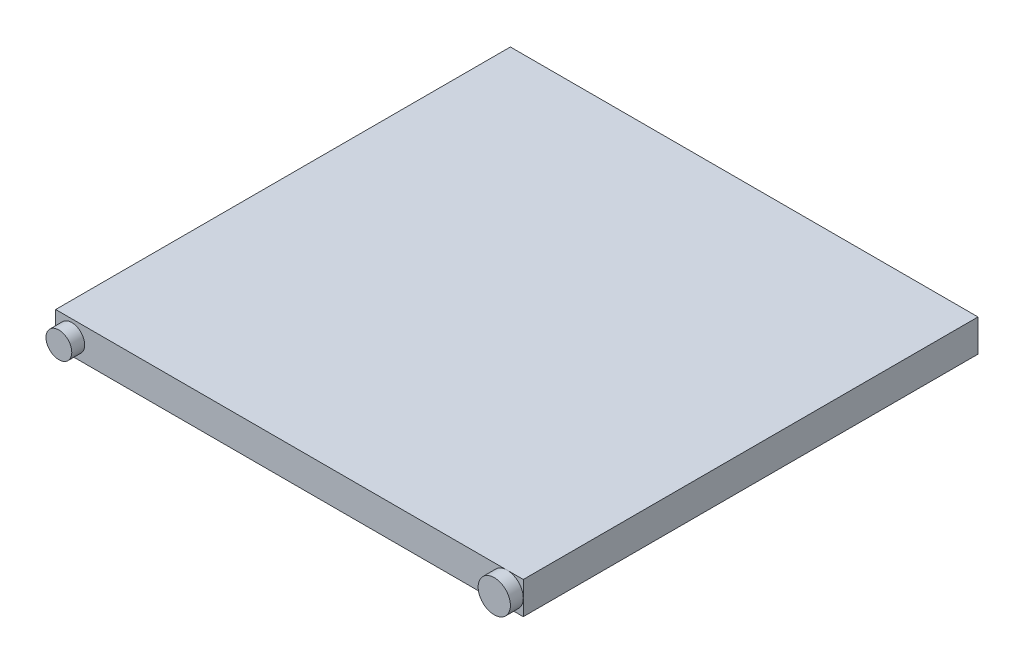
from build123d import *

# Parameters (mm, degrees)
SKETCH1_W                                    = 145
SKETCH1_H                                    = 145
BOSS_EXTRUDE1_PLATE_145X145X10_DEPTH         = 10
SKETCH2_R                                    = 5.5
CUT_EXTRUDE2_DEPTH                           = 3
SKETCH4_OUTSIDE_W                            = 188.06
SKETCH4_OUTSIDE_H                            = 53.06
SKETCH4_OUTSIDE_R                            = 4
SKETCH4_OUTSIDE_R_2                          = 5
CUT_EXTRUDE3_4_COUNTERBORES_8_DEPTH_4M_DEPTH = 4


with BuildPart() as part:
    # Sketch1 → Boss-Extrude1 (Plate 145x145x10) (new body)
    with BuildSketch(Plane(origin=(0, 0, 0), x_dir=(1, 0, 0), z_dir=(0, 1, 0))):
        with Locations((72.5, 72.5)):
            Rectangle(SKETCH1_W, SKETCH1_H)
    extrude(amount=BOSS_EXTRUDE1_PLATE_145X145X10_DEPTH)

    # Sketch2 → Cut-Extrude2 (cut)
    with BuildSketch(Plane(origin=(0, 0, 0), x_dir=(1, 0, 0), z_dir=(0, 1, 0))):
        with Locations(Location((15, 15, 0), (0, 0, 270))):
            Circle(SKETCH2_R)
        with Locations(Location((27.778, 15, 0), (0, 0, 270))):
            Circle(SKETCH2_R)
        with Locations(Location((40.556, 15, 0), (0, 0, 270))):
            Circle(SKETCH2_R)
        with Locations(Location((53.334, 15, 0), (0, 0, 270))):
            Circle(SKETCH2_R)
        with Locations(Location((66.112, 15, 0), (0, 0, 270))):
            Circle(SKETCH2_R)
        with Locations(Location((78.89, 15, 0), (0, 0, 270))):
            Circle(SKETCH2_R)
        with Locations(Location((91.668, 15, 0), (0, 0, 270))):
            Circle(SKETCH2_R)
        with Locations(Location((104.446, 15, 0), (0, 0, 270))):
            Circle(SKETCH2_R)
        with Locations(Location((117.224, 15, 0), (0, 0, 270))):
            Circle(SKETCH2_R)
        with Locations(Location((130.002, 15, 0), (0, 0, 270))):
            Circle(SKETCH2_R)
        with Locations(Location((15, 27.778, 0), (0, 0, 270))):
            Circle(SKETCH2_R)
        with Locations(Location((27.778, 27.778, 0), (0, 0, 270))):
            Circle(SKETCH2_R)
        with Locations(Location((40.556, 27.778, 0), (0, 0, 270))):
            Circle(SKETCH2_R)
        with Locations(Location((53.334, 27.778, 0), (0, 0, 270))):
            Circle(SKETCH2_R)
        with Locations(Location((66.112, 27.778, 0), (0, 0, 270))):
            Circle(SKETCH2_R)
        with Locations(Location((78.89, 27.778, 0), (0, 0, 270))):
            Circle(SKETCH2_R)
        with Locations(Location((91.668, 27.778, 0), (0, 0, 270))):
            Circle(SKETCH2_R)
        with Locations(Location((104.446, 27.778, 0), (0, 0, 270))):
            Circle(SKETCH2_R)
        with Locations(Location((117.224, 27.778, 0), (0, 0, 270))):
            Circle(SKETCH2_R)
        with Locations(Location((130.002, 27.778, 0), (0, 0, 270))):
            Circle(SKETCH2_R)
        with Locations(Location((15, 40.556, 0), (0, 0, 270))):
            Circle(SKETCH2_R)
        with Locations(Location((27.778, 40.556, 0), (0, 0, 270))):
            Circle(SKETCH2_R)
        with Locations(Location((40.556, 40.556, 0), (0, 0, 270))):
            Circle(SKETCH2_R)
        with Locations(Location((53.334, 40.556, 0), (0, 0, 270))):
            Circle(SKETCH2_R)
        with Locations(Location((66.112, 40.556, 0), (0, 0, 270))):
            Circle(SKETCH2_R)
        with Locations(Location((78.89, 40.556, 0), (0, 0, 270))):
            Circle(SKETCH2_R)
        with Locations(Location((91.668, 40.556, 0), (0, 0, 270))):
            Circle(SKETCH2_R)
        with Locations(Location((104.446, 40.556, 0), (0, 0, 270))):
            Circle(SKETCH2_R)
        with Locations(Location((117.224, 40.556, 0), (0, 0, 270))):
            Circle(SKETCH2_R)
        with Locations(Location((130.002, 40.556, 0), (0, 0, 270))):
            Circle(SKETCH2_R)
        with Locations(Location((15, 53.334, 0), (0, 0, 270))):
            Circle(SKETCH2_R)
        with Locations(Location((27.778, 53.334, 0), (0, 0, 270))):
            Circle(SKETCH2_R)
        with Locations(Location((40.556, 53.334, 0), (0, 0, 270))):
            Circle(SKETCH2_R)
        with Locations(Location((53.334, 53.334, 0), (0, 0, 270))):
            Circle(SKETCH2_R)
        with Locations(Location((66.112, 53.334, 0), (0, 0, 270))):
            Circle(SKETCH2_R)
        with Locations(Location((78.89, 53.334, 0), (0, 0, 270))):
            Circle(SKETCH2_R)
        with Locations(Location((91.668, 53.334, 0), (0, 0, 270))):
            Circle(SKETCH2_R)
        with Locations(Location((104.446, 53.334, 0), (0, 0, 270))):
            Circle(SKETCH2_R)
        with Locations(Location((117.224, 53.334, 0), (0, 0, 270))):
            Circle(SKETCH2_R)
        with Locations(Location((130.002, 53.334, 0), (0, 0, 270))):
            Circle(SKETCH2_R)
        with Locations(Location((15, 66.112, 0), (0, 0, 270))):
            Circle(SKETCH2_R)
        with Locations(Location((27.778, 66.112, 0), (0, 0, 270))):
            Circle(SKETCH2_R)
        with Locations(Location((40.556, 66.112, 0), (0, 0, 270))):
            Circle(SKETCH2_R)
        with Locations(Location((53.334, 66.112, 0), (0, 0, 270))):
            Circle(SKETCH2_R)
        with Locations(Location((66.112, 66.112, 0), (0, 0, 270))):
            Circle(SKETCH2_R)
        with Locations(Location((78.89, 66.112, 0), (0, 0, 270))):
            Circle(SKETCH2_R)
        with Locations(Location((91.668, 66.112, 0), (0, 0, 270))):
            Circle(SKETCH2_R)
        with Locations(Location((104.446, 66.112, 0), (0, 0, 270))):
            Circle(SKETCH2_R)
        with Locations(Location((117.224, 66.112, 0), (0, 0, 270))):
            Circle(SKETCH2_R)
        with Locations(Location((130.002, 66.112, 0), (0, 0, 270))):
            Circle(SKETCH2_R)
        with Locations(Location((15, 78.89, 0), (0, 0, 270))):
            Circle(SKETCH2_R)
        with Locations(Location((27.778, 78.89, 0), (0, 0, 270))):
            Circle(SKETCH2_R)
        with Locations(Location((40.556, 78.89, 0), (0, 0, 270))):
            Circle(SKETCH2_R)
        with Locations(Location((53.334, 78.89, 0), (0, 0, 270))):
            Circle(SKETCH2_R)
        with Locations(Location((66.112, 78.89, 0), (0, 0, 270))):
            Circle(SKETCH2_R)
        with Locations(Location((78.89, 78.89, 0), (0, 0, 270))):
            Circle(SKETCH2_R)
        with Locations(Location((91.668, 78.89, 0), (0, 0, 270))):
            Circle(SKETCH2_R)
        with Locations(Location((104.446, 78.89, 0), (0, 0, 270))):
            Circle(SKETCH2_R)
        with Locations(Location((117.224, 78.89, 0), (0, 0, 270))):
            Circle(SKETCH2_R)
        with Locations(Location((130.002, 78.89, 0), (0, 0, 270))):
            Circle(SKETCH2_R)
        with Locations(Location((15, 91.668, 0), (0, 0, 270))):
            Circle(SKETCH2_R)
        with Locations(Location((27.778, 91.668, 0), (0, 0, 270))):
            Circle(SKETCH2_R)
        with Locations(Location((40.556, 91.668, 0), (0, 0, 270))):
            Circle(SKETCH2_R)
        with Locations(Location((53.334, 91.668, 0), (0, 0, 270))):
            Circle(SKETCH2_R)
        with Locations(Location((66.112, 91.668, 0), (0, 0, 270))):
            Circle(SKETCH2_R)
        with Locations(Location((78.89, 91.668, 0), (0, 0, 270))):
            Circle(SKETCH2_R)
        with Locations(Location((91.668, 91.668, 0), (0, 0, 270))):
            Circle(SKETCH2_R)
        with Locations(Location((104.446, 91.668, 0), (0, 0, 270))):
            Circle(SKETCH2_R)
        with Locations(Location((117.224, 91.668, 0), (0, 0, 270))):
            Circle(SKETCH2_R)
        with Locations(Location((130.002, 91.668, 0), (0, 0, 270))):
            Circle(SKETCH2_R)
        with Locations(Location((15, 104.446, 0), (0, 0, 270))):
            Circle(SKETCH2_R)
        with Locations(Location((27.778, 104.446, 0), (0, 0, 270))):
            Circle(SKETCH2_R)
        with Locations(Location((40.556, 104.446, 0), (0, 0, 270))):
            Circle(SKETCH2_R)
        with Locations(Location((53.334, 104.446, 0), (0, 0, 270))):
            Circle(SKETCH2_R)
        with Locations(Location((66.112, 104.446, 0), (0, 0, 270))):
            Circle(SKETCH2_R)
        with Locations(Location((78.89, 104.446, 0), (0, 0, 270))):
            Circle(SKETCH2_R)
        with Locations(Location((91.668, 104.446, 0), (0, 0, 270))):
            Circle(SKETCH2_R)
        with Locations(Location((104.446, 104.446, 0), (0, 0, 270))):
            Circle(SKETCH2_R)
        with Locations(Location((117.224, 104.446, 0), (0, 0, 270))):
            Circle(SKETCH2_R)
        with Locations(Location((130.002, 104.446, 0), (0, 0, 270))):
            Circle(SKETCH2_R)
        with Locations(Location((15, 117.224, 0), (0, 0, 270))):
            Circle(SKETCH2_R)
        with Locations(Location((27.778, 117.224, 0), (0, 0, 270))):
            Circle(SKETCH2_R)
        with Locations(Location((40.556, 117.224, 0), (0, 0, 270))):
            Circle(SKETCH2_R)
        with Locations(Location((53.334, 117.224, 0), (0, 0, 270))):
            Circle(SKETCH2_R)
        with Locations(Location((66.112, 117.224, 0), (0, 0, 270))):
            Circle(SKETCH2_R)
        with Locations(Location((78.89, 117.224, 0), (0, 0, 270))):
            Circle(SKETCH2_R)
        with Locations(Location((91.668, 117.224, 0), (0, 0, 270))):
            Circle(SKETCH2_R)
        with Locations(Location((104.446, 117.224, 0), (0, 0, 270))):
            Circle(SKETCH2_R)
        with Locations(Location((117.224, 117.224, 0), (0, 0, 270))):
            Circle(SKETCH2_R)
        with Locations(Location((130.002, 117.224, 0), (0, 0, 270))):
            Circle(SKETCH2_R)
        with Locations(Location((15, 130.002, 0), (0, 0, 270))):
            Circle(SKETCH2_R)
        with Locations(Location((27.778, 130.002, 0), (0, 0, 270))):
            Circle(SKETCH2_R)
        with Locations(Location((40.556, 130.002, 0), (0, 0, 270))):
            Circle(SKETCH2_R)
        with Locations(Location((53.334, 130.002, 0), (0, 0, 270))):
            Circle(SKETCH2_R)
        with Locations(Location((66.112, 130.002, 0), (0, 0, 270))):
            Circle(SKETCH2_R)
        with Locations(Location((78.89, 130.002, 0), (0, 0, 270))):
            Circle(SKETCH2_R)
        with Locations(Location((91.668, 130.002, 0), (0, 0, 270))):
            Circle(SKETCH2_R)
        with Locations(Location((104.446, 130.002, 0), (0, 0, 270))):
            Circle(SKETCH2_R)
        with Locations(Location((117.224, 130.002, 0), (0, 0, 270))):
            Circle(SKETCH2_R)
        with Locations(Location((130.002, 130.002, 0), (0, 0, 270))):
            Circle(SKETCH2_R)
    extrude(amount=CUT_EXTRUDE2_DEPTH, mode=Mode.SUBTRACT)

    # Sketch4 outside → Cut-Extrude3 _4 Counterbores _8 Depth 4m (cut)
    with BuildSketch(Plane.XY):
        with Locations((72.5, 5)):
            Rectangle(SKETCH4_OUTSIDE_W, SKETCH4_OUTSIDE_H)
        with Locations((5, 5)):
            Circle(SKETCH4_OUTSIDE_R, mode=Mode.SUBTRACT)
        with Locations((140, 5)):
            Circle(SKETCH4_OUTSIDE_R_2, mode=Mode.SUBTRACT)
    extrude(amount=-CUT_EXTRUDE3_4_COUNTERBORES_8_DEPTH_4M_DEPTH, mode=Mode.SUBTRACT)


solid = part.part
